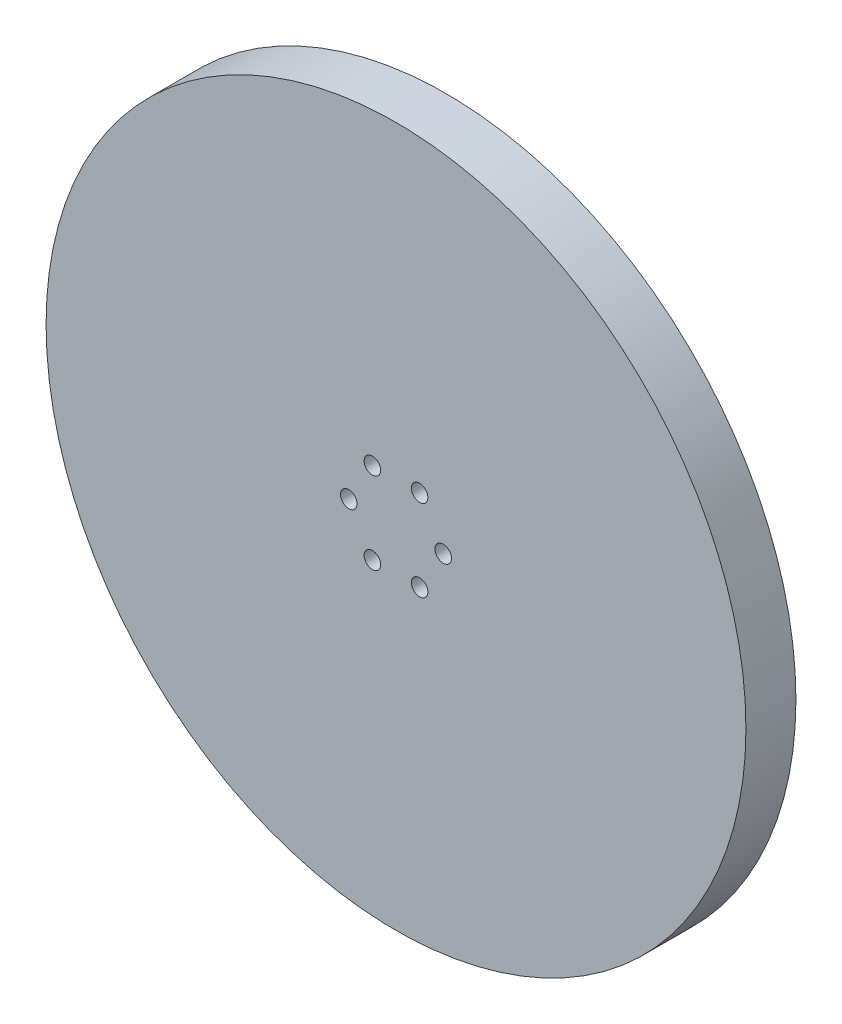
from build123d import *

# Parameters (mm, degrees)
SKETCH1_R           = 88.9
SKETCH1_R_2         = 2.1
BOSS_EXTRUDE1_DEPTH = 6.35
SKETCH2_R           = 57.3
CUT_EXTRUDE1_DEPTH  = 3


with BuildPart() as part:
    # Sketch1 → Boss-Extrude1 (new, symmetric)
    with BuildSketch(Plane.XY):
        Circle(SKETCH1_R)
        with Locations((-12, 0)):
            Circle(SKETCH1_R_2, mode=Mode.SUBTRACT)
        with Locations((-6, 10.392304845)):
            Circle(SKETCH1_R_2, mode=Mode.SUBTRACT)
        with Locations((6, 10.392304845)):
            Circle(SKETCH1_R_2, mode=Mode.SUBTRACT)
        with Locations((12, 0)):
            Circle(SKETCH1_R_2, mode=Mode.SUBTRACT)
        with Locations((6, -10.392304845)):
            Circle(SKETCH1_R_2, mode=Mode.SUBTRACT)
        with Locations((-6, -10.392304845)):
            Circle(SKETCH1_R_2, mode=Mode.SUBTRACT)
    extrude(amount=BOSS_EXTRUDE1_DEPTH, both=True)

    # Sketch2 → Cut-Extrude1 (cut)
    with BuildSketch(Plane(origin=(0, 0, -6.35), x_dir=(-1, 0, 0), z_dir=(0, 0, -1))):
        Circle(SKETCH2_R)
    extrude(amount=-CUT_EXTRUDE1_DEPTH, mode=Mode.SUBTRACT)


solid = part.part
